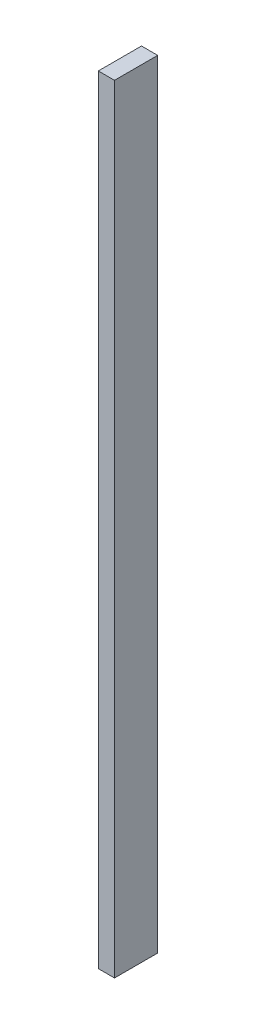
from build123d import *

# Parameters (mm, degrees)
SKETCH1_W           = 4.7625
SKETCH1_H           = 228.6
BOSS_EXTRUDE1_DEPTH = 12.7


with BuildPart() as part:
    # Sketch1 → Boss-Extrude1 (new body)
    with BuildSketch(Plane.XY):
        with Locations((2.38125, 114.3)):
            Rectangle(SKETCH1_W, SKETCH1_H)
    extrude(amount=BOSS_EXTRUDE1_DEPTH)


solid = part.part
